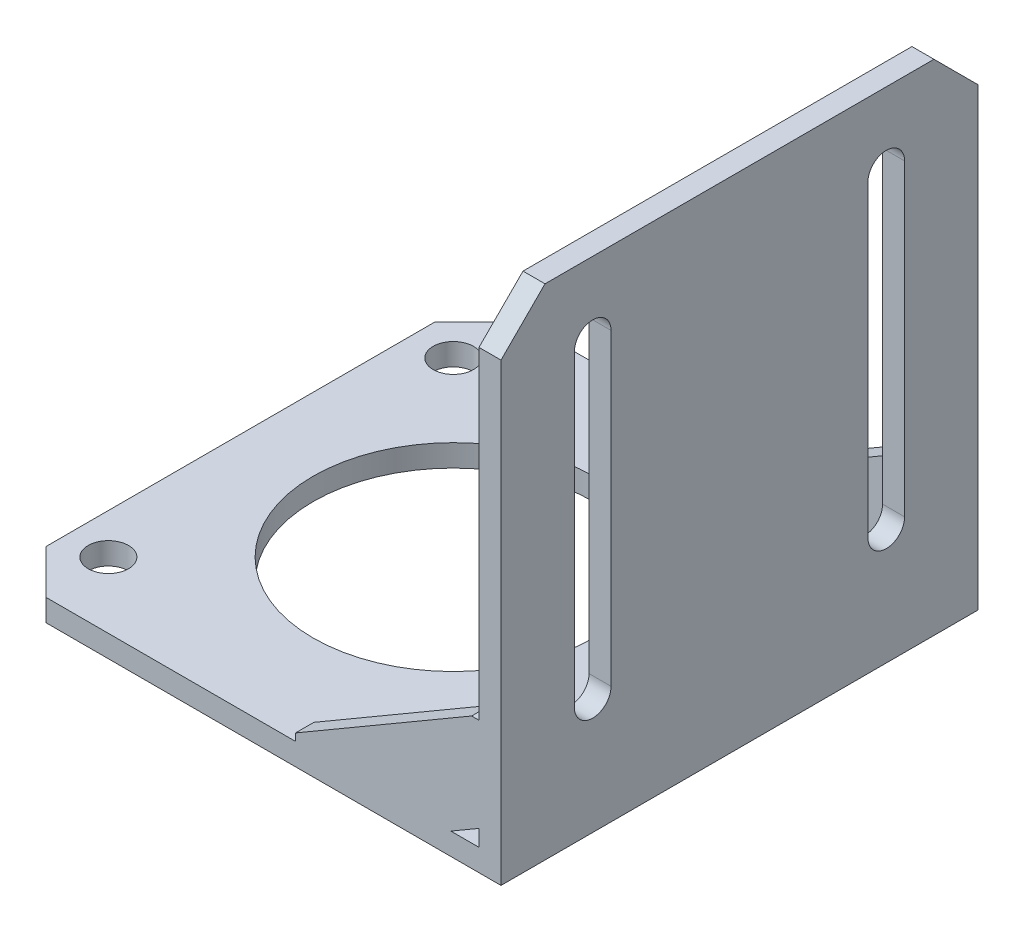
from build123d import *

# Parameters (mm, degrees)
SKETCH1_W           = 68
SKETCH1_H           = 65
BOSS_EXTRUDE1_DEPTH = 3
SKETCH2_W           = 3
SKETCH2_H           = 68
BOSS_EXTRUDE2_DEPTH = 65
CHAMFER1_SIZE       = 6
SKETCH4_R           = 2.75
SKETCH4_R_2         = 19.1
CUT_EXTRUDE2_DEPTH  = 65
CUT_EXTRUDE3_DEPTH  = 65
BOSS_EXTRUDE3_DEPTH = 2.5
BOSS_EXTRUDE4_DEPTH = 2.5


with BuildPart() as part:
    # Sketch1 → Boss-Extrude1 (new body)
    with BuildSketch(Plane(origin=(0, 0, 0), x_dir=(1, 0, 0), z_dir=(0, 1, 0))):
        Rectangle(SKETCH1_W, SKETCH1_H)
    extrude(amount=BOSS_EXTRUDE1_DEPTH)

    # Sketch2 → Boss-Extrude2 (add)
    with BuildSketch(Plane.XY.offset(32.5)):
        with Locations((32.5, 34)):
            Rectangle(SKETCH2_W, SKETCH2_H)
    extrude(amount=-BOSS_EXTRUDE2_DEPTH)

    # Chamfer1
    chamfer1_edges = [part.edges().sort_by_distance(p)[0] for p in [
        (32.5, 68, -32.5),
        (32.5, 68, 32.5),
        (-34, 1.5, -32.5),
        (-34, 1.5, 32.5),
    ]]
    chamfer(chamfer1_edges, length=CHAMFER1_SIZE)

    # Sketch4 → Cut-Extrude2 (cut)
    with BuildSketch(Plane(origin=(0, 3, 0), x_dir=(1, 0, 0), z_dir=(0, 1, 0))):
        with Locations(Location((-28.5, 23.5, 0), (0, 0, 270))):
            Circle(SKETCH4_R)
        with Locations(Location((-28.5, -23.5, 0), (0, 0, 270))):
            Circle(SKETCH4_R)
        with Locations(Location((18.6, -23.5, 0), (0, 0, 270))):
            Circle(SKETCH4_R)
        with Locations(Location((18.5, 23.5, 0), (0, 0, 270))):
            Circle(SKETCH4_R)
        with Locations(Location((-5, 0, 0), (0, 0, 270))):
            Circle(SKETCH4_R_2)
    extrude(amount=-CUT_EXTRUDE2_DEPTH, mode=Mode.SUBTRACT)

    # Sketch5 → Cut-Extrude3 (cut)
    with BuildSketch(Plane.ZY.offset(-31)):
        with BuildLine():
            Line((-17.5, 58), (-17.5, 16))
            ThreePointArc((-17.5, 16), (-20, 13.5), (-22.5, 16))
            Line((-22.5, 16), (-22.5, 58))
            ThreePointArc((-22.5, 58), (-20, 60.5), (-17.5, 58))
        make_face()
        with BuildLine():
            Line((22.5, 58), (22.5, 16))
            ThreePointArc((22.5, 16), (20, 13.5), (17.5, 16))
            Line((17.5, 16), (17.5, 58))
            ThreePointArc((17.5, 58), (20, 60.5), (22.5, 58))
        make_face()
    extrude(amount=-CUT_EXTRUDE3_DEPTH, mode=Mode.SUBTRACT)

    # Sketch6 → Boss-Extrude3 (add)
    with BuildSketch(Plane.XY.offset(32.5)):
        Polygon((6, 3), (6, 4), (30, 18), (31, 18), (31, 5.233358358), (27.171385671, 3), align=None)
    extrude(amount=-BOSS_EXTRUDE3_DEPTH)

    # Sketch7 → Boss-Extrude4 (add)
    with BuildSketch(Plane(origin=(0, 0, -32.5), x_dir=(-1, 0, 0), z_dir=(0, 0, -1))):
        Polygon((-31, 18), (-30, 18), (-6, 4), (-6, 3), (-27.171385671, 3), (-31, 5.233358358), align=None)
    extrude(amount=-BOSS_EXTRUDE4_DEPTH)


solid = part.part
